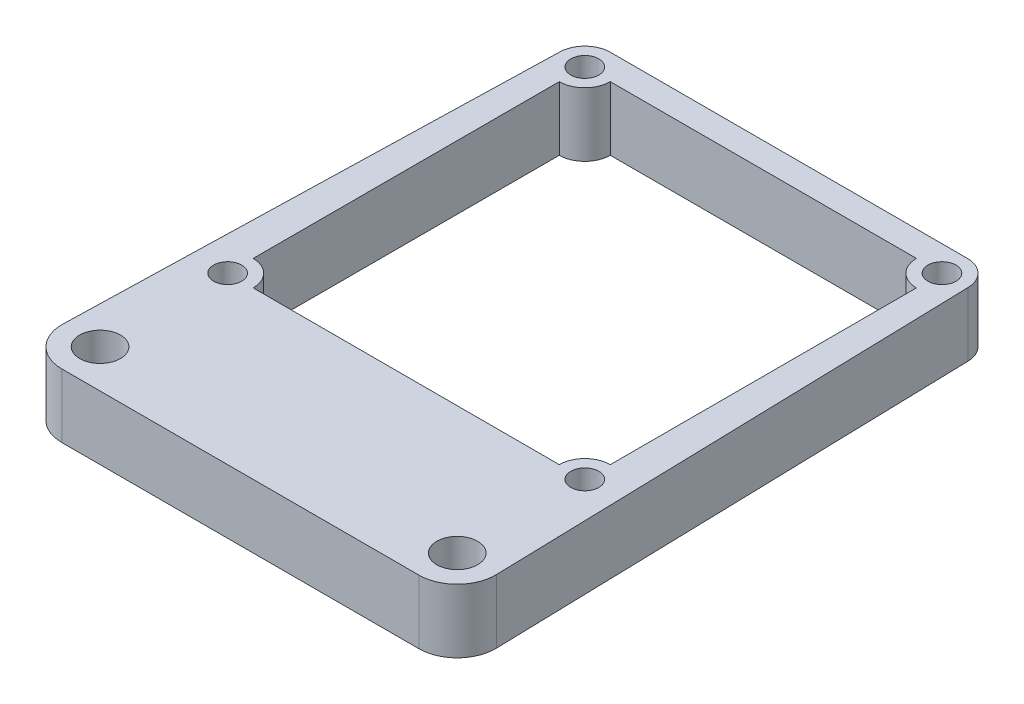
from build123d import *

# Parameters (mm, degrees)
SKETCH_1_R      = 1.1
SKETCH_1_R_2    = 1.6
EXTRUDE_1_DEPTH = 5


with BuildPart() as part:
    # ｽｹｯﾁ1 → ﾎﾞｽ - 押し出し1 (new body)
    with BuildSketch(Plane(origin=(0, 0, 0), x_dir=(1, 0, 0), z_dir=(0, 1, 0))):
        with BuildLine():
            Line((-15.999307359, 14.052631579), (-16.998961039, -23.921052632))
            ThreePointArc((-16.998961039, -23.921052632), (-16.149051198, -26.093222145), (-14, -27))
            Line((-14, -27), (14, -27))
            ThreePointArc((14, -27), (16.149051198, -26.093222145), (16.998961039, -23.921052632))
            Line((16.998961039, -23.921052632), (15.999307359, 14.052631579))
            ThreePointArc((15.999307359, 14.052631579), (15.39548143, 15.432700799), (14, 16))
            Line((14, 16), (-14, 16))
            ThreePointArc((-14, 16), (-15.39548143, 15.432700799), (-15.999307359, 14.052631579))
        make_face()
        with Locations(Location((-14, 14, 0), (0, 0, 270))):
            Circle(SKETCH_1_R, mode=Mode.SUBTRACT)
        with Locations(Location((14, 14, 0), (0, 0, 270))):
            Circle(SKETCH_1_R, mode=Mode.SUBTRACT)
        with Locations(Location((14, -14, 0), (0, 0, 270))):
            Circle(SKETCH_1_R, mode=Mode.SUBTRACT)
        with Locations(Location((-14, -14, 0), (0, 0, 270))):
            Circle(SKETCH_1_R, mode=Mode.SUBTRACT)
        with Locations(Location((-14, -24, 0), (0, 0, 270))):
            Circle(SKETCH_1_R_2, mode=Mode.SUBTRACT)
        with Locations(Location((14, -24, 0), (0, 0, 270))):
            Circle(SKETCH_1_R_2, mode=Mode.SUBTRACT)
        with BuildLine():
            Line((-14, 12), (-14, -12))
            ThreePointArc((-14, -12), (-12.585786438, -12.585786438), (-12, -14))
            Line((-12, -14), (12, -14))
            ThreePointArc((12, -14), (12.585786438, -12.585786438), (14, -12))
            Line((14, -12), (14, 12))
            ThreePointArc((14, 12), (12.585786438, 12.585786438), (12, 14))
            Line((12, 14), (-12, 14))
            ThreePointArc((-12, 14), (-12.585786438, 12.585786438), (-14, 12))
        make_face(mode=Mode.SUBTRACT)
    extrude(amount=EXTRUDE_1_DEPTH)


solid = part.part
